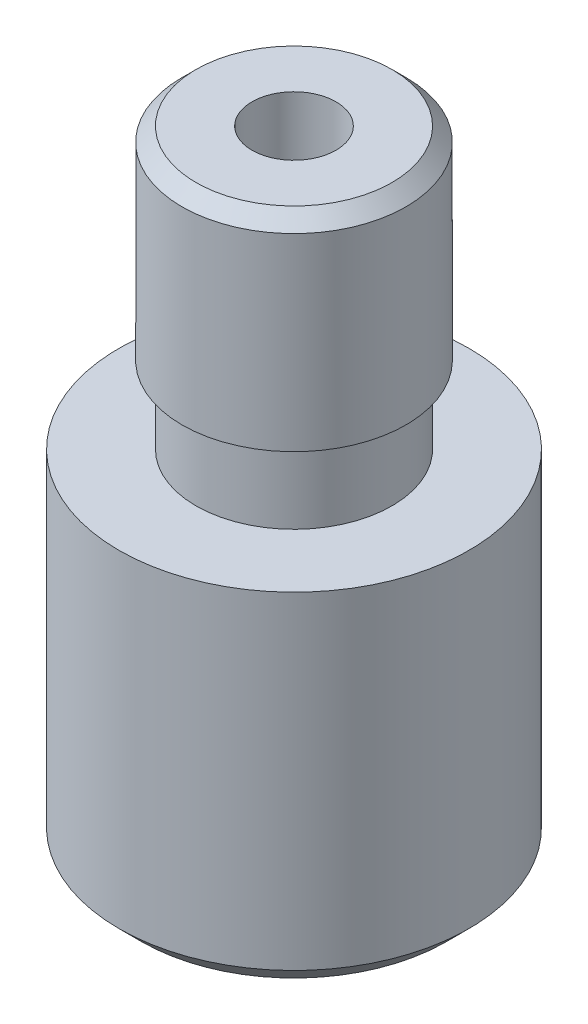
from build123d import *

# Parameters (mm, degrees)
CHAMFER_1_SIZE = 1.6
CHAMFER_2_SIZE = 1


with BuildPart() as part:
    # Эскиз1 → Повернуть1 (revolve)
    with BuildSketch(Plane.XY, mode=Mode.PRIVATE) as revolve_1_sk:
        Polygon((3, -30.508474576), (12.5, -30.508474576), (12.5, -5.508474576), (7, -5.508474576), (7, 0), (8, 0), (8, 14.491525424), (3, 14.491525424), align=None)
    revolve(revolve_1_sk.sketch.rotate(Axis((0, 36.610169492, 0), (0, -1, 0)), 90), axis=Axis((0, 36.610169492, 0), (0, -1, 0)))

    # Фаска1
    chamfer_1_edges = [part.edges().sort_by_distance(p)[0] for p in [
        (0, -30.508474576, -12.5),
    ]]
    chamfer(chamfer_1_edges, length=CHAMFER_1_SIZE)

    # Фаска2
    chamfer_2_edges = [part.edges().sort_by_distance(p)[0] for p in [
        (0, 14.491525424, -8),
    ]]
    chamfer(chamfer_2_edges, length=CHAMFER_2_SIZE)


solid = part.part
